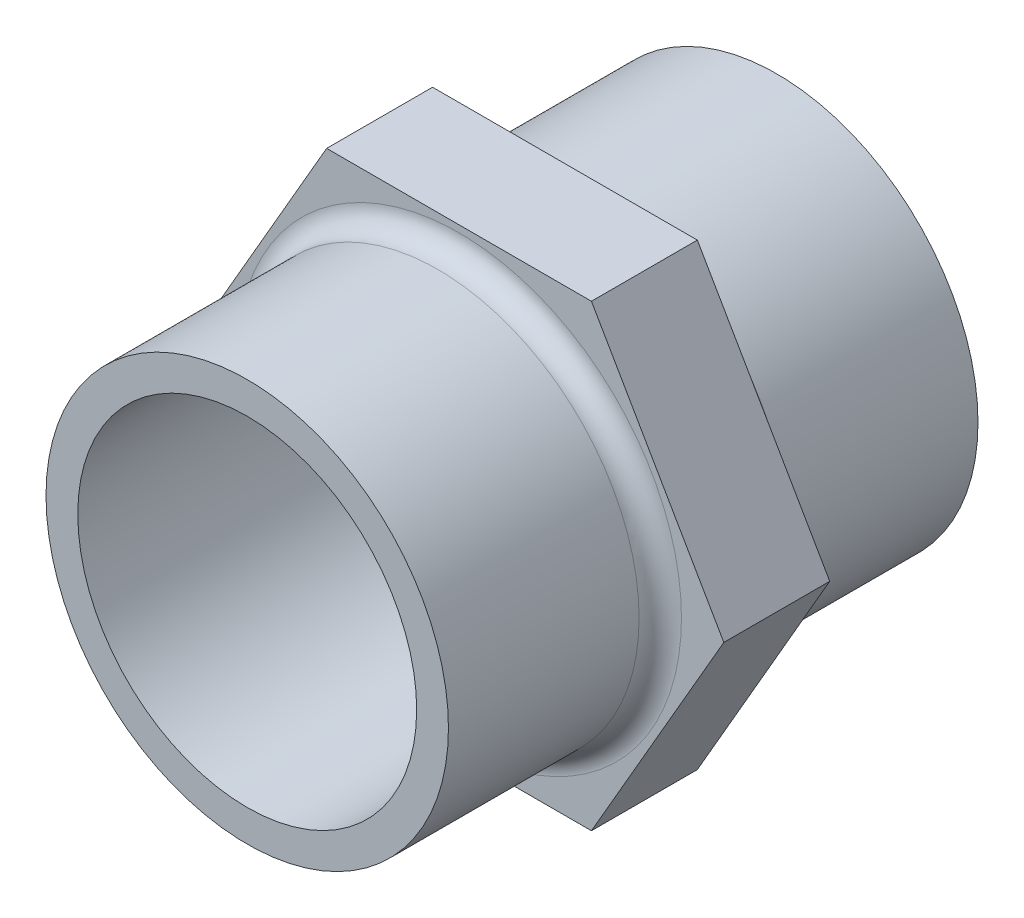
from build123d import *

# Parameters (mm, degrees)
BOSS_EXTRUDE1_DEPTH     = 2.5
SKETCH2_R               = 9.5
BOSS_EXTRUDE2_DEPTH     = 12.5
CUT_EXTRUDE1_DEPTH      = 21.72890494
CUT_EXTRUDE1_DEPTH_BACK = 21.72890494
SKETCH3_R               = 8
FILLET1_R               = 1


with BuildPart() as part:
    # Sketch1 → Boss-Extrude1 (new, symmetric)
    with BuildSketch(Plane.XY):
        Polygon((-12.5, 0), (-6.25, 10.825317547), (6.25, 10.825317547), (12.5, 0), (6.25, -10.825317547), (-6.25, -10.825317547), align=None)
    extrude(amount=BOSS_EXTRUDE1_DEPTH, both=True)

    # Sketch2 → Boss-Extrude2 (add, symmetric)
    with BuildSketch(Plane.XY):
        Circle(SKETCH2_R)
    extrude(amount=BOSS_EXTRUDE2_DEPTH, both=True)

    # Sketch3 → Cut-Extrude1 (cut, two sides: drawn at the far end of the back side and taken through both)
    with BuildSketch(Plane.XY.offset(-CUT_EXTRUDE1_DEPTH_BACK)):
        Circle(SKETCH3_R)
    extrude(amount=CUT_EXTRUDE1_DEPTH + CUT_EXTRUDE1_DEPTH_BACK, mode=Mode.SUBTRACT)

    # Fillet1
    fillet1_edges = [part.edges().sort_by_distance(p)[0] for p in [
        (-9.5, 0, -2.5),
        (-9.5, 0, 2.5),
    ]]
    fillet(fillet1_edges, radius=FILLET1_R)


solid = part.part
